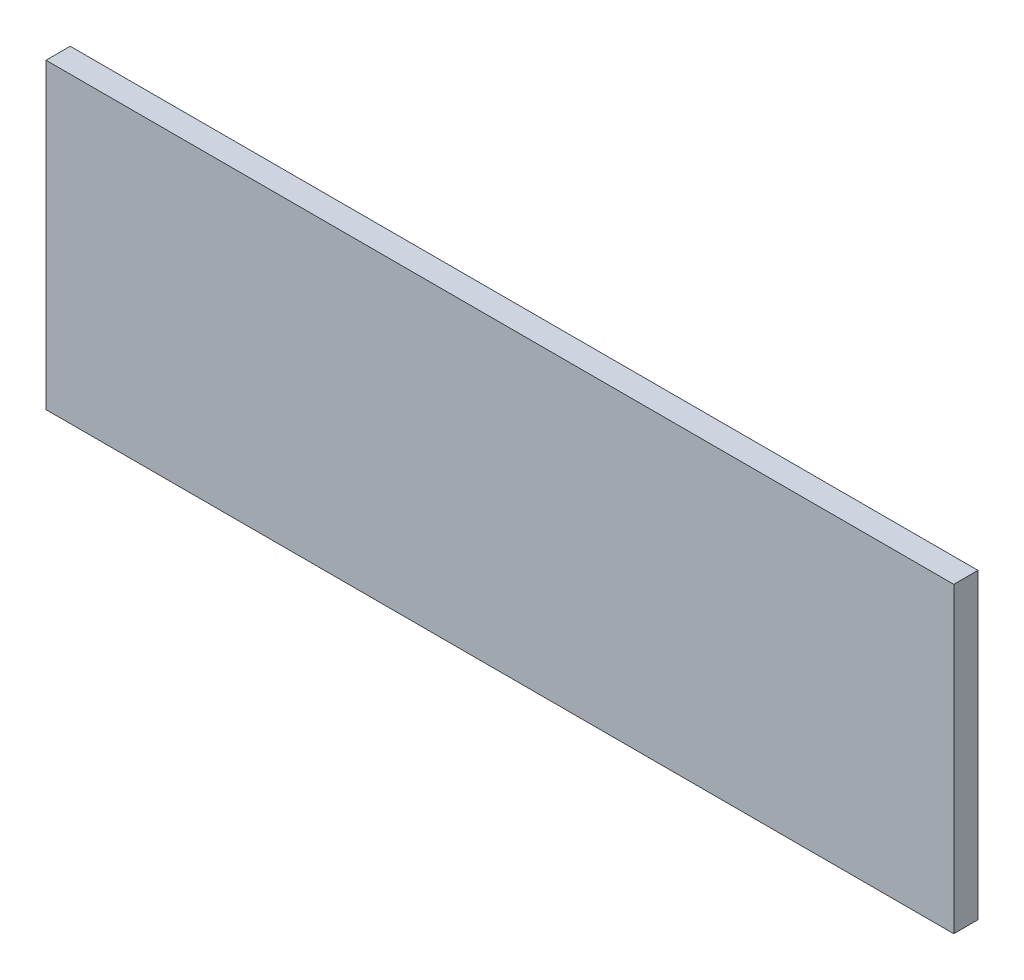
from build123d import *

# Parameters (mm, degrees)
SKETCH1_W           = 4
SKETCH1_H           = 50
BOSS_EXTRUDE1_DEPTH = 75


with BuildPart() as part:
    # Sketch1 → Boss-Extrude1 (new, symmetric)
    with BuildSketch(Plane(origin=(0, 0, 0), x_dir=(0, 0, -1), z_dir=(1, 0, 0))):
        Rectangle(SKETCH1_W, SKETCH1_H)
    extrude(amount=BOSS_EXTRUDE1_DEPTH, both=True)


solid = part.part
